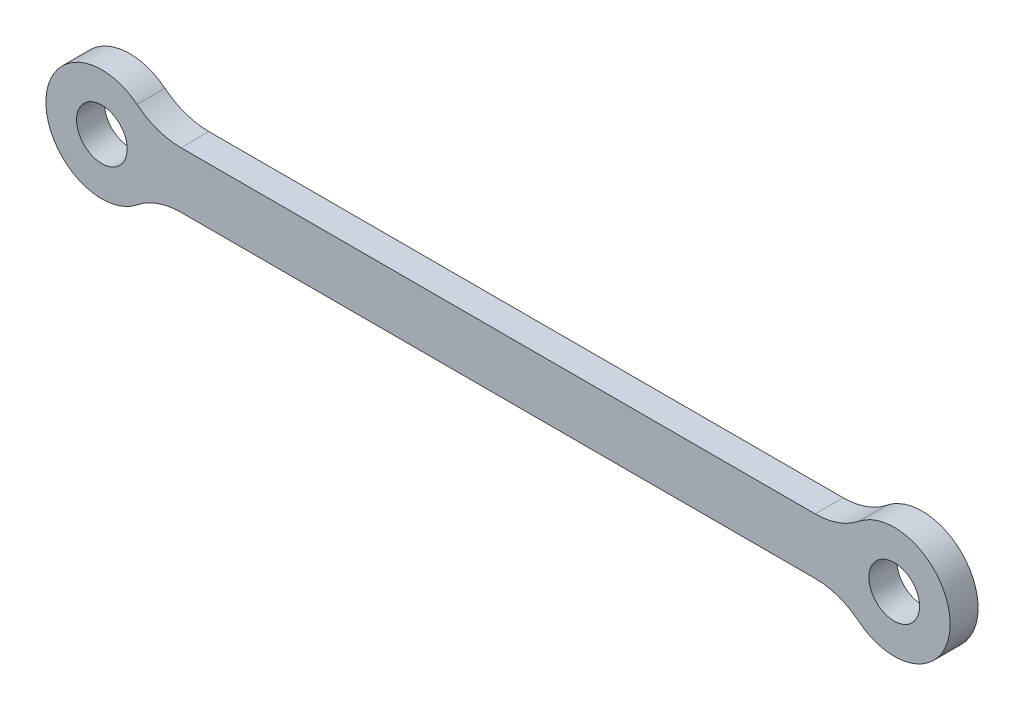
from build123d import *

# Parameters (mm, degrees)
SKETCH1_R           = 4.60375
BOSS_EXTRUDE1_DEPTH = 5.08


with BuildPart() as part:
    # Sketch1 → Boss-Extrude1 (new body)
    with BuildSketch(Plane.XY):
        with BuildLine():
            Line((14.368409794, 5.08), (129.56492354, 5.08))
            ThreePointArc((129.56492354, 5.08), (133.798256873, 5.806325172), (137.547373425, 7.902222222))
            ThreePointArc((137.547373425, 7.902222222), (154.093333333, 0), (137.547373425, -7.902222222))
            ThreePointArc((137.547373425, -7.902222222), (133.798256873, -5.806325172), (129.56492354, -5.08))
            Line((129.56492354, -5.08), (14.368409794, -5.08))
            ThreePointArc((14.368409794, -5.08), (10.13507646, -5.806325172), (6.385959908, -7.902222222))
            ThreePointArc((6.385959908, -7.902222222), (-10.16, 0), (6.385959908, 7.902222222))
            ThreePointArc((6.385959908, 7.902222222), (10.13507646, 5.806325172), (14.368409794, 5.08))
        make_face()
        Circle(SKETCH1_R, mode=Mode.SUBTRACT)
        with Locations((143.933333333, 0)):
            Circle(SKETCH1_R, mode=Mode.SUBTRACT)
    extrude(amount=BOSS_EXTRUDE1_DEPTH)


solid = part.part
